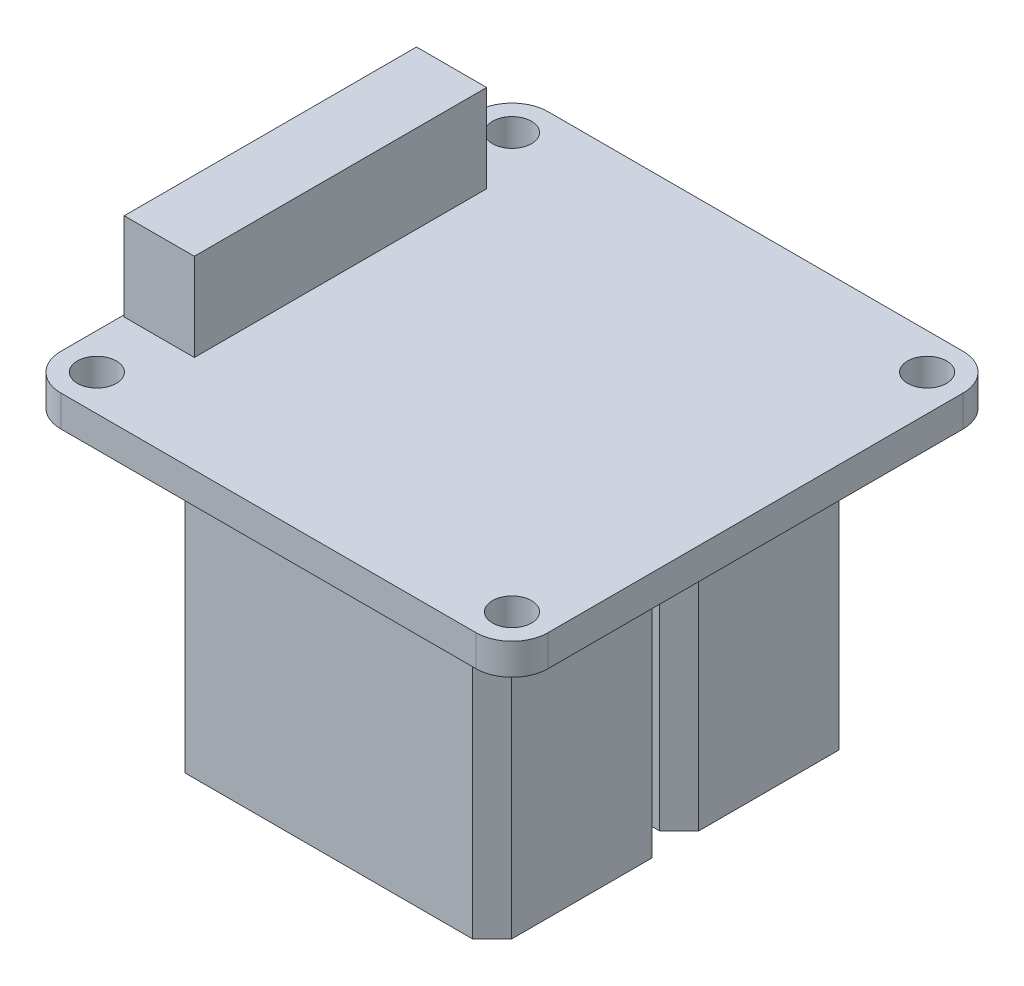
from build123d import *

# Parameters (mm, degrees)
SKETCH_1_R          = 1
EXTRUDE_1_DEPTH     = 1.6
SKETCH_2_W          = 16.76
SKETCH_2_H          = 9.2
EXTRUDE_2_DEPTH     = 15.2
CUT_EXTRUDE_START   = -15.2
SKETCH_3_W          = 12.83
SKETCH_3_H          = 1.6
CUT_EXTRUDE_2_DEPTH = 9
CUT_EXTRUDE_3_DEPTH = 15.2
EXTRUDE_START       = 1.6
SKETCH_7_W          = 3.6
SKETCH_7_H          = 15
EXTRUDE_4_DEPTH     = 4.5


with BuildPart() as part:
    # 草图1 → 凸台-拉伸1 (new body)
    with BuildSketch(Plane(origin=(0, 0, 0), x_dir=(1, 0, 0), z_dir=(0, 1, 0))):
        with BuildLine():
            Line((-10.65, 12.5), (10.65, 12.5))
            ThreePointArc((10.65, 12.5), (11.958147545, 11.958147545), (12.5, 10.65))
            Line((12.5, 10.65), (12.5, -10.65))
            ThreePointArc((12.5, -10.65), (11.958147545, -11.958147545), (10.65, -12.5))
            Line((10.65, -12.5), (-10.65, -12.5))
            ThreePointArc((-10.65, -12.5), (-11.958147545, -11.958147545), (-12.5, -10.65))
            Line((-12.5, -10.65), (-12.5, 10.65))
            ThreePointArc((-12.5, 10.65), (-11.958147545, 11.958147545), (-10.65, 12.5))
        make_face()
        with Locations(Location((-10.65, 10.65, 0), (0, 0, 270))):
            Circle(SKETCH_1_R, mode=Mode.SUBTRACT)
        with Locations(Location((-10.65, -10.65, 0), (0, 0, 270))):
            Circle(SKETCH_1_R, mode=Mode.SUBTRACT)
        with Locations(Location((10.65, -10.65, 0), (0, 0, 270))):
            Circle(SKETCH_1_R, mode=Mode.SUBTRACT)
        with Locations(Location((10.65, 10.65, 0), (0, 0, 270))):
            Circle(SKETCH_1_R, mode=Mode.SUBTRACT)
    extrude(amount=EXTRUDE_1_DEPTH)

    # 草图2 → 凸台-拉伸2 (add)
    with BuildSketch(Plane(origin=(0, 0, 0), x_dir=(1, 0, 0), z_dir=(0, 1, 0))):
        with Locations((0, 4.8)):
            Rectangle(SKETCH_2_W, SKETCH_2_H)
        with Locations((0, -4.8)):
            Rectangle(SKETCH_2_W, SKETCH_2_H)
    extrude(amount=-EXTRUDE_2_DEPTH)

    # 草图3 → 切除-拉伸2 (cut)
    with BuildSketch(Plane(origin=(0, 0, 0), x_dir=(1, 0, 0), z_dir=(0, 1, 0)).offset(CUT_EXTRUDE_START)):
        with Locations((0, -4.8)):
            Rectangle(SKETCH_3_W, SKETCH_3_H)
        with Locations((0, 4.8)):
            Rectangle(SKETCH_3_W, SKETCH_3_H)
    extrude(amount=CUT_EXTRUDE_2_DEPTH, mode=Mode.SUBTRACT)

    # 草图5 → 切除-拉伸3 (cut)
    with BuildSketch(Plane(origin=(0, 0, 0), x_dir=(1, 0, 0), z_dir=(0, 1, 0)).offset(CUT_EXTRUDE_START)):
        Polygon((-8.38, -9.4), (-8.38, -8.4), (-7.38, -9.4), align=None)
        Polygon((7.38, -9.4), (8.38, -9.4), (8.38, -8.4), align=None)
        Polygon((-8.38, -0.2), (-8.38, -1.2), (-7.38, -0.2), align=None)
        Polygon((8.38, -0.2), (7.38, -0.2), (8.38, -1.2), align=None)
        Polygon((-8.38, 0.2), (-7.38, 0.2), (-8.38, 1.2), align=None)
        Polygon((-8.38, 9.4), (-7.38, 9.4), (-8.38, 8.4), align=None)
        Polygon((8.38, 9.4), (7.38, 9.4), (8.38, 8.4), align=None)
        Polygon((7.38, 0.2), (8.38, 0.2), (8.38, 1.2), align=None)
    extrude(amount=CUT_EXTRUDE_3_DEPTH, mode=Mode.SUBTRACT)

    # 草图7 → 凸台-拉伸4 (add)
    with BuildSketch(Plane(origin=(0, 0, 0), x_dir=(1, 0, 0), z_dir=(0, 1, 0)).offset(EXTRUDE_START)):
        with Locations((-10.6, 0)):
            Rectangle(SKETCH_7_W, SKETCH_7_H)
    extrude(amount=EXTRUDE_4_DEPTH)


solid = part.part
